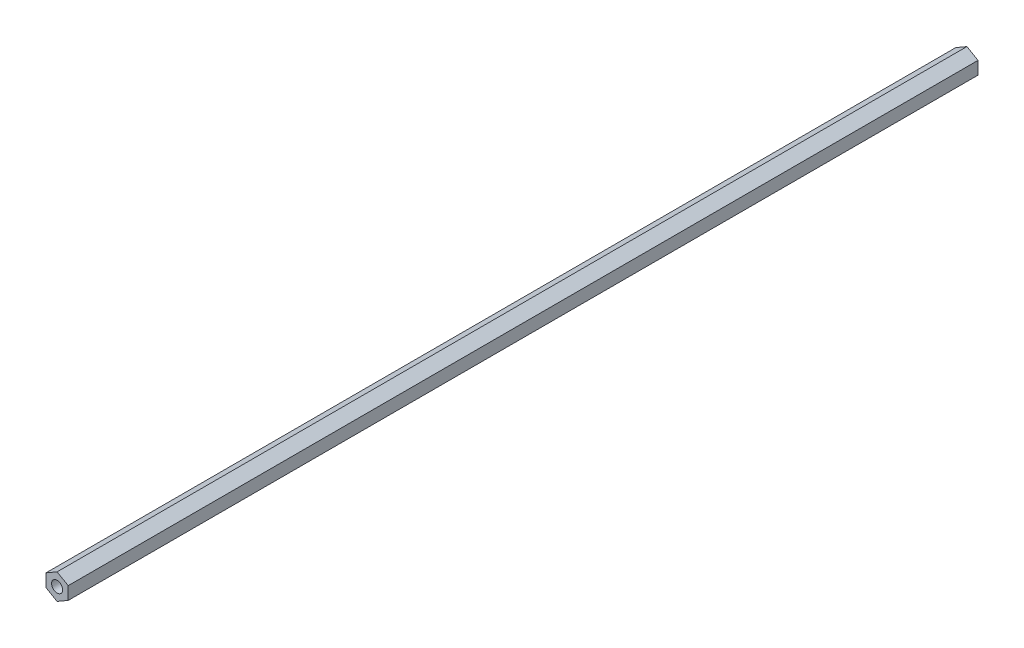
from build123d import *

# Parameters (mm, degrees)
BOSS_EXTRUDE2_DEPTH             = 260.35
BOSS_EXTRUDE2_DEPTH_BACK        = 260.35
F_1_4_0_25_DIAMETER_HOLE1_D     = 6.35
F_1_4_0_25_DIAMETER_HOLE1_DEPTH = 25.4
F_1_4_0_25_DIAMETER_HOLE1_TIP   = 1.907732465
F_1_4_0_25_DIAMETER_HOLE2_D     = 6.35
F_1_4_0_25_DIAMETER_HOLE2_DEPTH = 25.4
F_1_4_0_25_DIAMETER_HOLE2_TIP   = 1.907732465


with BuildPart() as part:
    # Sketch3 → Boss-Extrude2 (new, two sides: drawn at the far end of the back side and taken through both)
    with BuildSketch(Plane.XY.offset(-BOSS_EXTRUDE2_DEPTH_BACK)):
        Polygon((-6.35, -3.666174209), (0, -7.332348419), (6.35, -3.666174209), (6.35, 3.666174209), (0, 7.332348419), (-6.35, 3.666174209), align=None)
    extrude(amount=BOSS_EXTRUDE2_DEPTH + BOSS_EXTRUDE2_DEPTH_BACK)

    # 1/4 (0.25) Diameter Hole1
    with Locations(Plane.XY.offset(260.35)):
        with Locations((0, 0)):
            Hole(F_1_4_0_25_DIAMETER_HOLE1_D / 2, depth=F_1_4_0_25_DIAMETER_HOLE1_DEPTH)
            with Locations((0, 0, -(F_1_4_0_25_DIAMETER_HOLE1_DEPTH + F_1_4_0_25_DIAMETER_HOLE1_TIP / 2))):  # 118° drill point
                Cone(0, F_1_4_0_25_DIAMETER_HOLE1_D / 2, F_1_4_0_25_DIAMETER_HOLE1_TIP, mode=Mode.SUBTRACT)

    # 1/4 (0.25) Diameter Hole2
    with Locations(Plane(origin=(0, 0, -260.35), x_dir=(-1, 0, 0), z_dir=(0, 0, -1))):
        with Locations((0, 0)):
            Hole(F_1_4_0_25_DIAMETER_HOLE2_D / 2, depth=F_1_4_0_25_DIAMETER_HOLE2_DEPTH)
            with Locations((0, 0, -(F_1_4_0_25_DIAMETER_HOLE2_DEPTH + F_1_4_0_25_DIAMETER_HOLE2_TIP / 2))):  # 118° drill point
                Cone(0, F_1_4_0_25_DIAMETER_HOLE2_D / 2, F_1_4_0_25_DIAMETER_HOLE2_TIP, mode=Mode.SUBTRACT)


solid = part.part
